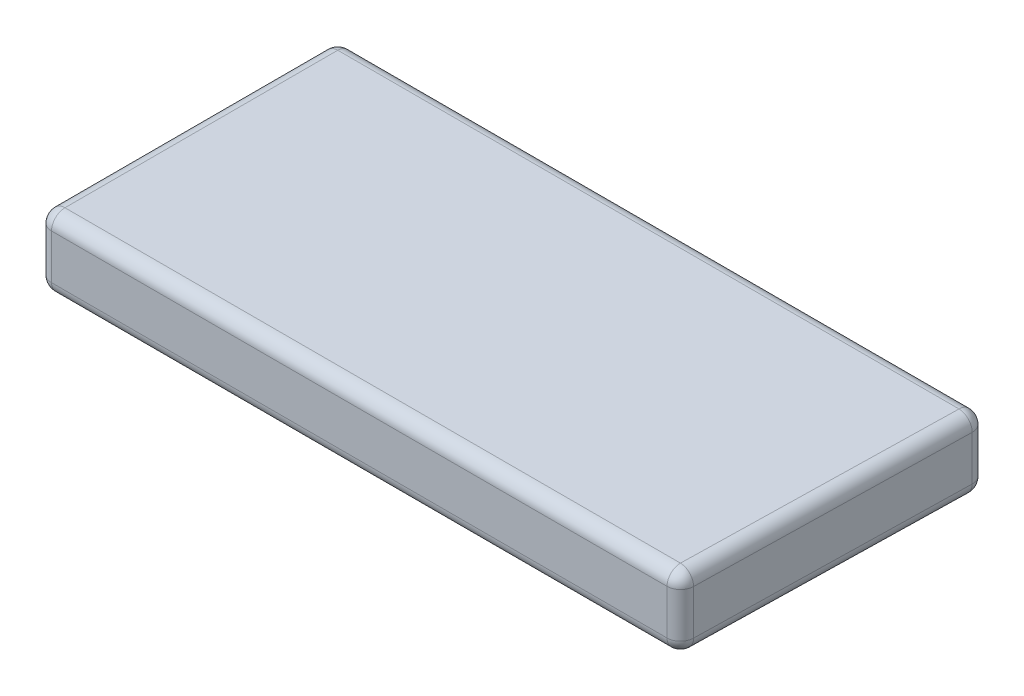
from build123d import *

# Parameters (mm, degrees)
BOSS_EXTRUDE2_DEPTH      = 8
BOSS_EXTRUDE2_DEPTH_BACK = 8
SKETCH3_W                = 12.5
SKETCH3_H                = 5
SKETCH3_W_2              = 5.918941358
SKETCH3_H_2              = 2.496427957
CUT_EXTRUDE1_DEPTH       = 8
FILLET1_R                = 3
FILLET2_R                = 1
FILLET3_R                = 0.5


with BuildPart() as part:
    # Sketch2 → Boss-Extrude2 (new, two sides: drawn at the far end of the back side and taken through both)
    with BuildSketch(Plane(origin=(0, 0, 0), x_dir=(1, 0, 0), z_dir=(0, 1, 0)).offset(-BOSS_EXTRUDE2_DEPTH_BACK)):
        Polygon((-72.495595293, -0.799164043), (-72.495595293, 33.5), (72.495595293, 33.5), (71.070165431, -33.5), (-72.495595293, -33.5), align=None)
    extrude(amount=BOSS_EXTRUDE2_DEPTH + BOSS_EXTRUDE2_DEPTH_BACK)

    # Sketch3 → Cut-Extrude1 (cut)
    with BuildSketch(Plane.ZY.offset(72.495595293)):
        with Locations((-17.25, 0.071666465)):
            Rectangle(SKETCH3_W, SKETCH3_H)
        with Locations((17.25, 0.071666465)):
            Rectangle(SKETCH3_W, SKETCH3_H)
        with Locations((-0.029122914, 0.052810579)):
            Rectangle(SKETCH3_W_2, SKETCH3_H_2)
    extrude(amount=-CUT_EXTRUDE1_DEPTH, mode=Mode.SUBTRACT)

    # Fillet1
    fillet1_edges = [part.edges().sort_by_distance(p)[0] for p in [
        (72.495595293, 0, -33.5),
        (0, 8, -33.5),
        (-72.495595293, 0, -33.5),
        (71.782880362, -8, 0),
        (0, -8, -33.5),
        (-72.495595293, -8, 0),
        (-0.712714931, -8, 33.5),
        (-72.495595293, 0, 33.5),
        (-0.712714931, 8, 33.5),
        (71.070165431, 0, 33.5),
        (71.782880362, 8, 0),
        (-72.495595293, 8, 0),
    ]]
    fillet(fillet1_edges, radius=FILLET1_R)

    # Fillet2
    fillet2_edges = [part.edges().sort_by_distance(p)[0] for p in [
        (-72.495595293, 0.071666465, 11),
        (-72.495595293, 2.571666465, 17.25),
        (-72.495595293, 0.071666465, 23.5),
        (-72.495595293, -2.428333535, 17.25),
        (-72.495595293, -2.428333535, -17.25),
        (-72.495595293, 0.071666465, -23.5),
        (-72.495595293, 2.571666465, -17.25),
        (-72.495595293, 0.071666465, -11),
    ]]
    fillet(fillet2_edges, radius=FILLET2_R)

    # Fillet3
    fillet3_edges = [part.edges().sort_by_distance(p)[0] for p in [
        (-72.495595293, 1.301024557, -0.029122914),
        (-72.495595293, 0.052810578, -2.988593593),
        (-72.495595293, -1.1954034, -0.029122914),
        (-72.495595293, 0.052810578, 2.930347765),
    ]]
    fillet(fillet3_edges, radius=FILLET3_R)


solid = part.part
